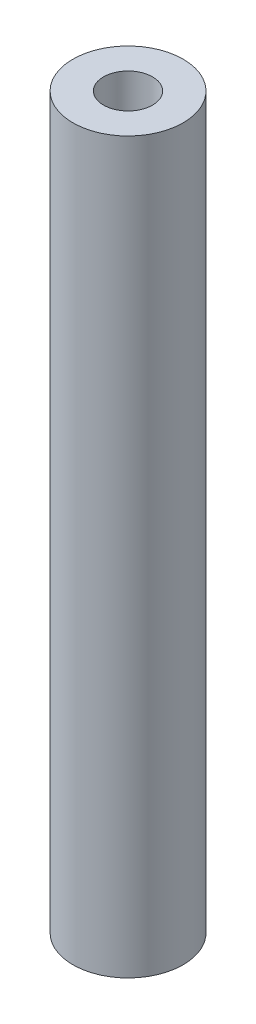
from build123d import *

# Parameters (mm, degrees)
SKETCH1_R           = 2.7
SKETCH1_R_2         = 1.2
BOSS_EXTRUDE1_DEPTH = 35.7


with BuildPart() as part:
    # Sketch1 → Boss-Extrude1 (new body)
    with BuildSketch(Plane(origin=(0, 0, 0), x_dir=(1, 0, 0), z_dir=(0, 1, 0))):
        with Locations(Location((0, 0, 0), (0, 0, 90))):
            Circle(SKETCH1_R)
        with Locations(Location((0, 0, 0), (0, 0, 90))):
            Circle(SKETCH1_R_2, mode=Mode.SUBTRACT)
    extrude(amount=BOSS_EXTRUDE1_DEPTH)


solid = part.part
